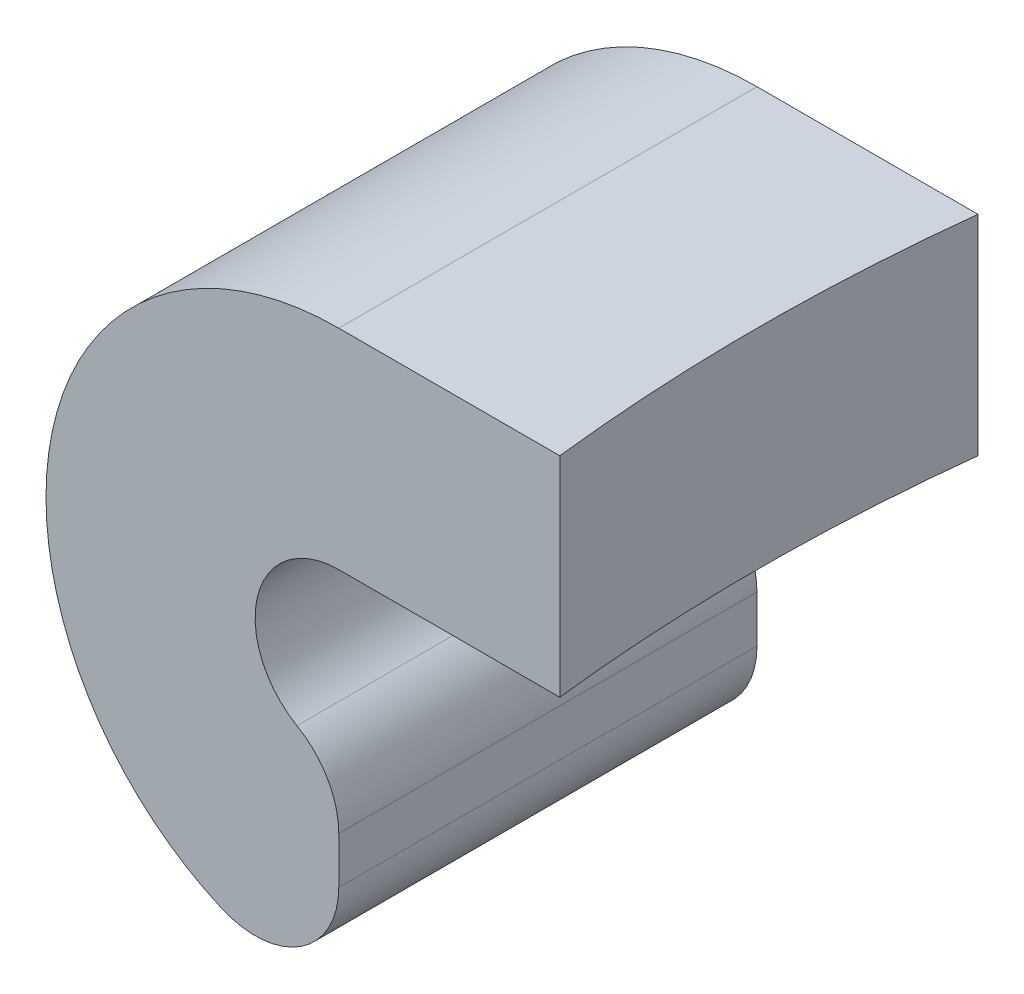
from build123d import *

# Parameters (mm, degrees)
BOSS_EXTRUDE1_DEPTH = 2.5
SKETCH2_R           = 22
CUT_EXTRUDE1_DEPTH  = 9.383366498


with BuildPart() as part:
    # Sketch1 → Boss-Extrude1 (new, symmetric)
    with BuildSketch(Plane.XY):
        with BuildLine():
            Line((0, -2.732050808), (0, -3.291287847))
            ThreePointArc((0, -3.291287847), (-0.452277442, -4.127947874), (-1.4, -4.207802986))
            ThreePointArc((-1.4, -4.207802986), (-3.426172095, -0.284916247), (0, 2.5))
            Line((0, 2.5), (6.753938291, 2.5))
            Line((6.753938291, 2.5), (6.753938291, 0))
            Line((6.753938291, 0), (0, 0))
            ThreePointArc((0, 0), (-0.965925826, -0.741180955), (-0.5, -1.866025404))
            ThreePointArc((-0.5, -1.866025404), (-0.133974596, -2.232050808), (0, -2.732050808))
        make_face()
    extrude(amount=BOSS_EXTRUDE1_DEPTH, both=True)

    # Sketch2 → Cut-Extrude1 (cut, through all)
    with BuildSketch(Plane(origin=(0, 0, 0), x_dir=(1, 0, 0), z_dir=(0, 1, 0))):
        with Locations((24.5, 0)):
            Circle(SKETCH2_R)
    extrude(amount=CUT_EXTRUDE1_DEPTH, mode=Mode.SUBTRACT)


solid = part.part
